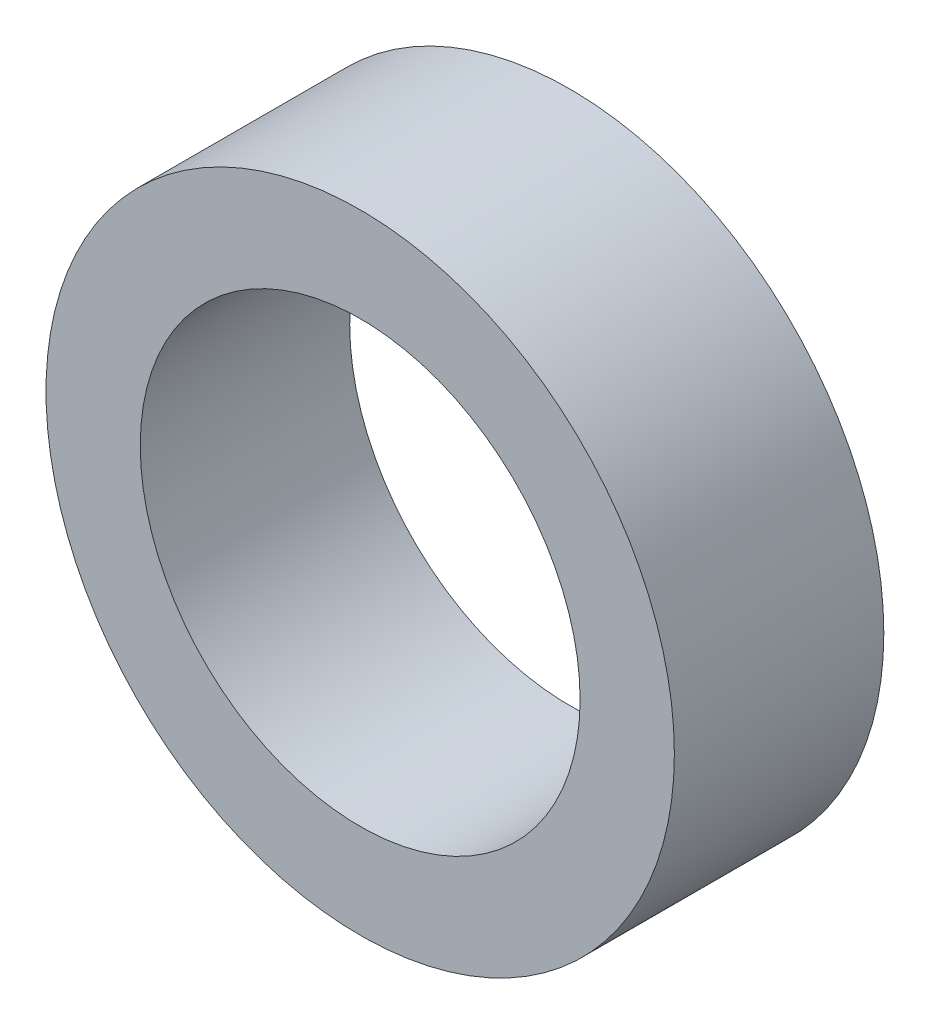
from build123d import *

# Parameters (mm, degrees)
SKETCH1_R           = 7.5
SKETCH1_R_2         = 5.25
BOSS_EXTRUDE1_DEPTH = 5


with BuildPart() as part:
    # Sketch1 → Boss-Extrude1 (new body)
    with BuildSketch(Plane.XY):
        Circle(SKETCH1_R)
        Circle(SKETCH1_R_2, mode=Mode.SUBTRACT)
    extrude(amount=BOSS_EXTRUDE1_DEPTH)


solid = part.part
